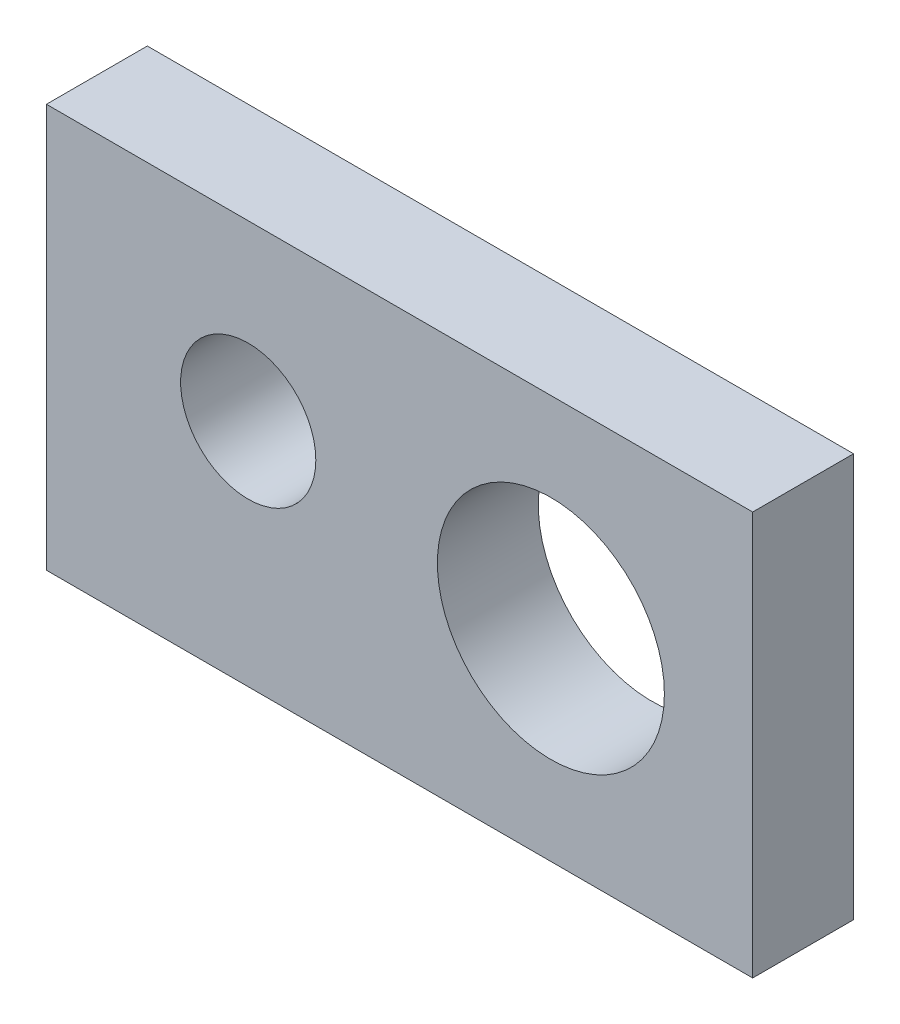
from build123d import *

# Parameters (mm, degrees)
SKETCH1_W           = 88.9
SKETCH1_H           = 50.8
BOSS_EXTRUDE1_DEPTH = 12.7
SKETCH2_R           = 14.2875
SKETCH2_R_2         = 8.509
CUT_EXTRUDE1_DEPTH  = 104.175287739


with BuildPart() as part:
    # Sketch1 → Boss-Extrude1 (new body)
    with BuildSketch(Plane.XY):
        with Locations((44.45, 25.4)):
            Rectangle(SKETCH1_W, SKETCH1_H)
    extrude(amount=BOSS_EXTRUDE1_DEPTH)

    # Sketch2 → Cut-Extrude1 (cut, through all)
    with BuildSketch(Plane.XY.offset(12.7)):
        with Locations((63.5, 25.4)):
            Circle(SKETCH2_R)
        with Locations((25.4, 28.956)):
            Circle(SKETCH2_R_2)
    extrude(amount=-CUT_EXTRUDE1_DEPTH, mode=Mode.SUBTRACT)


solid = part.part
